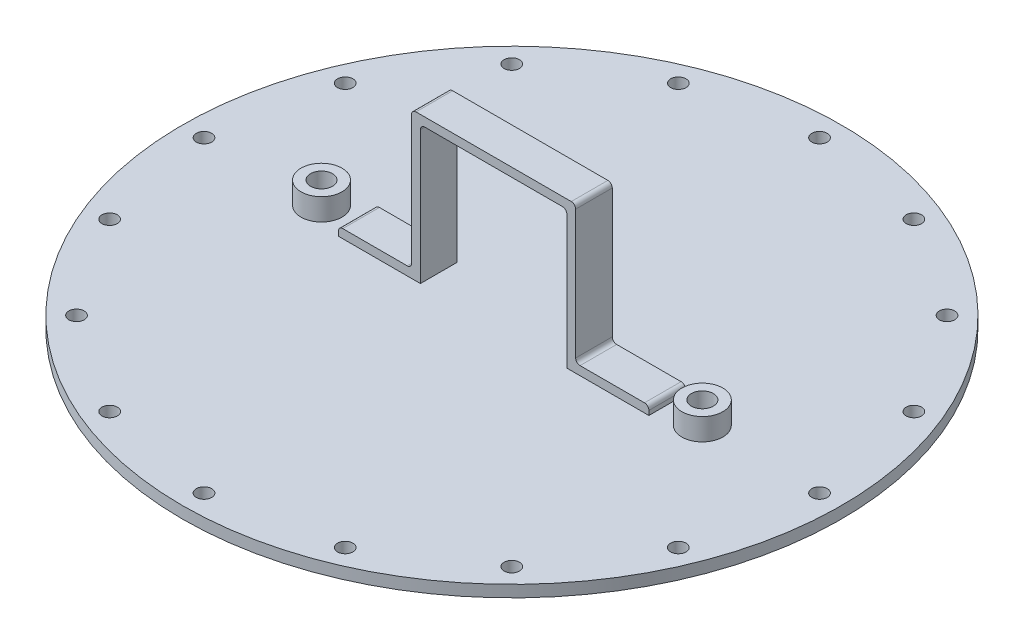
from build123d import *

# Parameters (mm, degrees)
SKETCH1_R           = 225
BOSS_EXTRUDE1_DEPTH = 8
SKETCH2_R           = 5.25
CUT_EXTRUDE1_DEPTH  = 319.298601945
CIRPATTERN1_COUNT   = 16
SKETCH3_R           = 14
BOSS_EXTRUDE2_DEPTH = 15
SKETCH4_R           = 7.5
CUT_EXTRUDE2_DEPTH  = 320.028211919
SKETCH5_R           = 14
BOSS_EXTRUDE3_DEPTH = 15
SKETCH6_R           = 7.5
CUT_EXTRUDE3_DEPTH  = 320.028211919
BOSS_EXTRUDE4_DEPTH = 12.5
FILLET1_R           = 3


with BuildPart() as part:
    # Sketch1 → Boss-Extrude1 (new body)
    with BuildSketch(Plane(origin=(0, 0, 0), x_dir=(1, 0, 0), z_dir=(0, 1, 0))):
        with Locations(Location((0, 0, 0), (0, 0, 270))):
            Circle(SKETCH1_R)
    extrude(amount=BOSS_EXTRUDE1_DEPTH)

    # Sketch2 → Cut-Extrude1 (cut, through all)
    with BuildSketch(Plane(origin=(0, 8, 0), x_dir=(1, 0, 0), z_dir=(0, 1, 0))):
        with Locations(Location((0, 210, 0), (0, 0, 270))):
            Circle(SKETCH2_R)
    cut_extrude1 = extrude(amount=-CUT_EXTRUDE1_DEPTH, mode=Mode.SUBTRACT)

    # CirPattern1: Cut-Extrude1 ×16 about axis
    cirpattern1_axis = Axis((0, 0, 0.114395615), (0, 1, 0))
    for i in range(1, CIRPATTERN1_COUNT):
        add(cut_extrude1.rotate(cirpattern1_axis, i * 360 / CIRPATTERN1_COUNT), mode=Mode.SUBTRACT)

    # Sketch3 → Boss-Extrude2 (add)
    with BuildSketch(Plane(origin=(0, 8, 0), x_dir=(1, 0, 0), z_dir=(0, 1, 0))):
        with Locations(Location((-130, 0, 0), (0, 0, 270))):
            Circle(SKETCH3_R)
    extrude(amount=BOSS_EXTRUDE2_DEPTH)

    # Sketch4 → Cut-Extrude2 (cut, through all)
    with BuildSketch(Plane(origin=(0, 23, 0), x_dir=(1, 0, 0), z_dir=(0, 1, 0))):
        with Locations(Location((-130, 0, 0), (0, 0, 270))):
            Circle(SKETCH4_R)
    extrude(amount=-CUT_EXTRUDE2_DEPTH, mode=Mode.SUBTRACT)

    # Sketch5 → Boss-Extrude3 (add)
    with BuildSketch(Plane(origin=(0, 8, 0), x_dir=(1, 0, 0), z_dir=(0, 1, 0))):
        with Locations(Location((130, 0, 0), (0, 0, 270))):
            Circle(SKETCH5_R)
    extrude(amount=BOSS_EXTRUDE3_DEPTH)

    # Sketch6 → Cut-Extrude3 (cut, through all)
    with BuildSketch(Plane(origin=(0, 23, 0), x_dir=(1, 0, 0), z_dir=(0, 1, 0))):
        with Locations(Location((130, 0, 0), (0, 0, 270))):
            Circle(SKETCH6_R)
    extrude(amount=-CUT_EXTRUDE3_DEPTH, mode=Mode.SUBTRACT)

    # Sketch7 → Boss-Extrude4 (add, symmetric)
    with BuildSketch(Plane.XY):
        Polygon((-106, 8), (-106, 14), (-56, 14), (-56, 108), (56, 108), (56, 14), (106, 14), (106, 8), (50, 8), (50, 102), (-50, 102), (-50, 8), align=None)
    extrude(amount=BOSS_EXTRUDE4_DEPTH, both=True)

    # Fillet1
    fillet1_edges = [part.edges().sort_by_distance(p)[0] for p in [
        (-50, 102, 0),
        (50, 102, 0),
        (106, 14, 0),
        (56, 14, 0),
        (56, 108, 0),
        (-56, 108, 0),
        (-56, 14, 0),
        (-106, 14, 0),
    ]]
    fillet(fillet1_edges, radius=FILLET1_R)


solid = part.part
